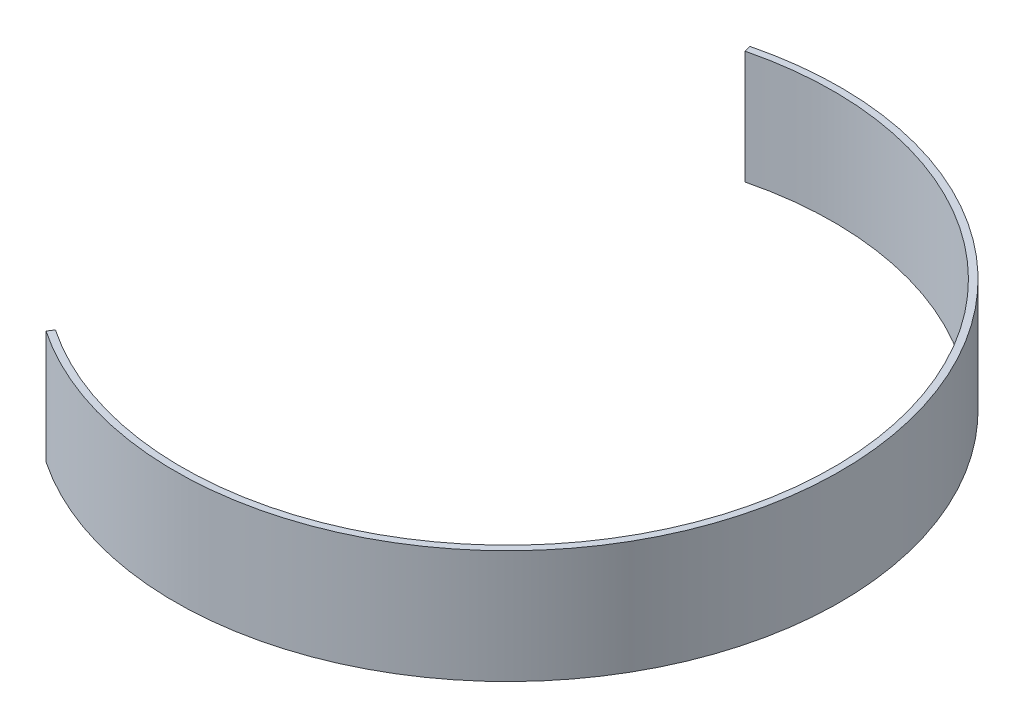
from build123d import *

# Parameters (mm, degrees)
EXTRUDE_1_DEPTH = 20


with BuildPart() as part:
    # 草图1 → 凸台-拉伸1 (new body)
    with BuildSketch(Plane(origin=(0, 0, 0), x_dir=(1, 0, 0), z_dir=(0, 1, 0))):
        with BuildLine():
            Line((-14.200815272, 56.956359132), (-13.910508997, 55.792004261))
            ThreePointArc((-13.910508997, 55.792004261), (56.626445798, -9.984770216), (-32.15359195, -47.669660422))
            Line((-32.15359195, -47.669660422), (-32.824623434, -48.664505509))
            ThreePointArc((-32.824623434, -48.664505509), (57.808215102, -10.193148029), (-14.200815272, 56.956359132))
        make_face()
    extrude(amount=EXTRUDE_1_DEPTH)


solid = part.part
